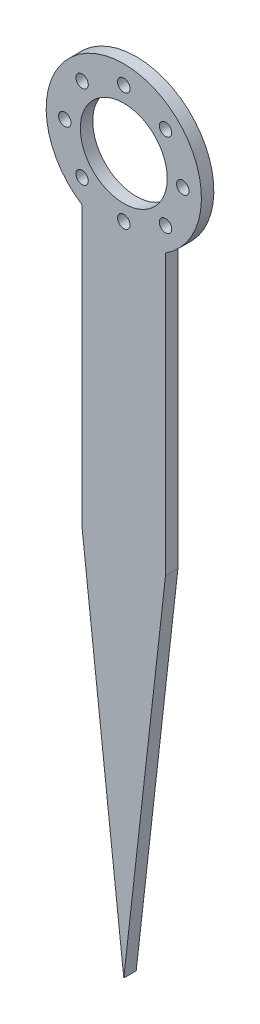
from build123d import *

# Parameters (mm, degrees)
SKETCH_1_R      = 14
SKETCH_1_R_2    = 2
EXTRUDE_1_DEPTH = 4


with BuildPart() as part:
    # 草图1 → 凸台-拉伸1 (new body)
    with BuildSketch(Plane.XY):
        with BuildLine():
            Line((-13.435028843, -21.083168642), (-13.435028843, -111.083168642))
            Line((-13.435028843, -111.083168642), (0, -230))
            Line((0, -230), (13.435028843, -111.083168642))
            Line((13.435028843, -111.083168642), (13.435028843, -21.083168642))
            ThreePointArc((13.435028843, -21.083168642), (0, 25), (-13.435028843, -21.083168642))
        make_face()
        Circle(SKETCH_1_R, mode=Mode.SUBTRACT)
        with Locations((0, 19)):
            Circle(SKETCH_1_R_2, mode=Mode.SUBTRACT)
        with Locations((13.435028843, 13.435028843)):
            Circle(SKETCH_1_R_2, mode=Mode.SUBTRACT)
        with Locations((19, 0)):
            Circle(SKETCH_1_R_2, mode=Mode.SUBTRACT)
        with Locations((13.435028843, -13.435028843)):
            Circle(SKETCH_1_R_2, mode=Mode.SUBTRACT)
        with Locations((0, -19)):
            Circle(SKETCH_1_R_2, mode=Mode.SUBTRACT)
        with Locations((-13.435028843, -13.435028843)):
            Circle(SKETCH_1_R_2, mode=Mode.SUBTRACT)
        with Locations((-19, 0)):
            Circle(SKETCH_1_R_2, mode=Mode.SUBTRACT)
        with Locations((-13.435028843, 13.435028843)):
            Circle(SKETCH_1_R_2, mode=Mode.SUBTRACT)
    extrude(amount=EXTRUDE_1_DEPTH)


solid = part.part
